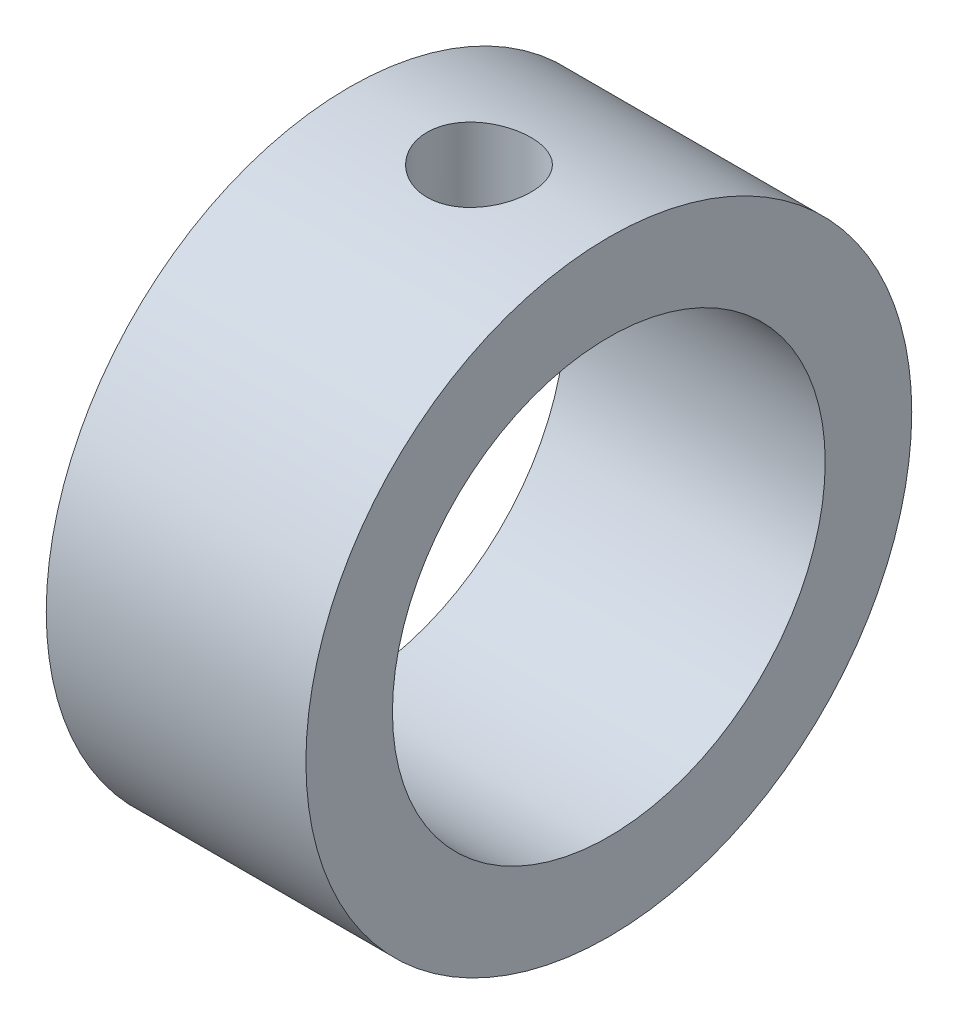
from build123d import *

# Parameters (mm, degrees)
SKETCH1_R           = 17.5
SKETCH1_R_2         = 12.5
BOSS_EXTRUDE1_DEPTH = 15
SKETCH2_R           = 3
CUT_EXTRUDE1_DEPTH  = 30


with BuildPart() as part:
    # Sketch1 → Boss-Extrude1 (new body)
    with BuildSketch(Plane(origin=(0, 0, 0), x_dir=(0, 0, -1), z_dir=(1, 0, 0))):
        Circle(SKETCH1_R)
        Circle(SKETCH1_R_2, mode=Mode.SUBTRACT)
    extrude(amount=BOSS_EXTRUDE1_DEPTH)

    # Sketch2 → Cut-Extrude1 (cut)
    with BuildSketch(Plane(origin=(0, 0, 0), x_dir=(1, 0, 0), z_dir=(0, 1, 0))):
        with Locations(Location((7.5, 0, 0), (0, 0, 90))):
            Circle(SKETCH2_R)
    extrude(amount=CUT_EXTRUDE1_DEPTH, mode=Mode.SUBTRACT)


solid = part.part
